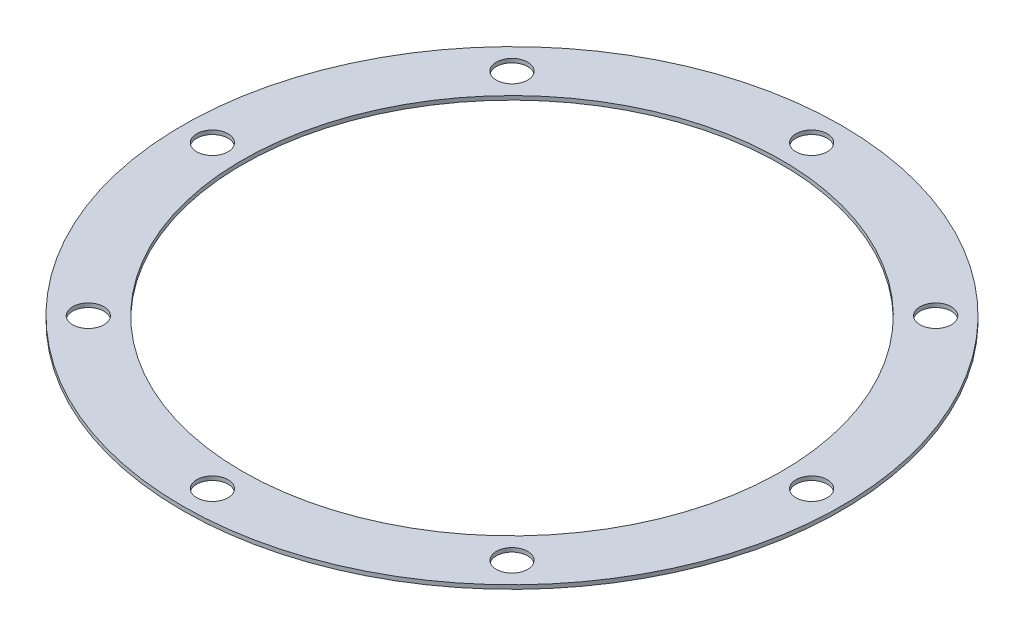
from build123d import *

# Parameters (mm, degrees)
SKETCH1_R           = 69.85
SKETCH1_R_2         = 57.15
BOSS_EXTRUDE1_DEPTH = 0.8382
SKETCH2_R           = 3.3147
CUT_EXTRUDE1_DEPTH  = 2.54
CIRPATTERN1_COUNT   = 8


with BuildPart() as part:
    # Sketch1 → Boss-Extrude1 (new body)
    with BuildSketch(Plane(origin=(0, 0, 0), x_dir=(1, 0, 0), z_dir=(0, 1, 0))):
        Circle(SKETCH1_R)
        Circle(SKETCH1_R_2, mode=Mode.SUBTRACT)
    extrude(amount=BOSS_EXTRUDE1_DEPTH)

    # Sketch2 → Cut-Extrude1 (cut)
    with BuildSketch(Plane(origin=(0, 0.8382, 0), x_dir=(1, 0, 0), z_dir=(0, 1, 0))):
        with Locations((0, 63.5)):
            Circle(SKETCH2_R)
    cut_extrude1 = extrude(amount=-CUT_EXTRUDE1_DEPTH, mode=Mode.SUBTRACT)

    # CirPattern1: Cut-Extrude1 ×8 about axis
    cirpattern1_axis = Axis((0, -0.04191, 0), (0, 1, 0))
    for i in range(1, CIRPATTERN1_COUNT):
        add(cut_extrude1.rotate(cirpattern1_axis, i * 360 / CIRPATTERN1_COUNT), mode=Mode.SUBTRACT)


solid = part.part
